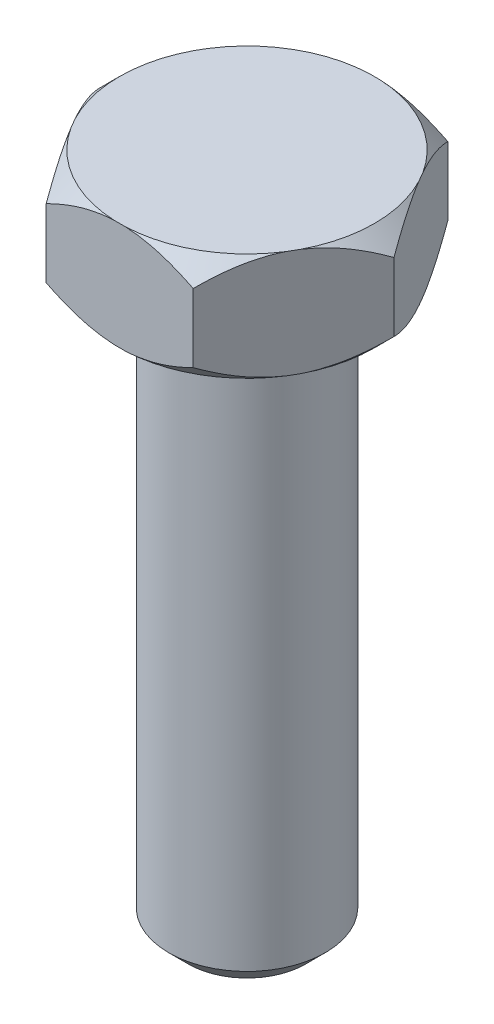
from build123d import *

# Parameters (mm, degrees)
EXTRUDE_1_DEPTH = 5.5
SKETCH_5_R      = 4
EXTRUDE_2_DEPTH = 29
CHAMFER_1_SIZE  = 1


with BuildPart() as part:
    # Эскиз1 → Вытянуть1 (new body)
    with BuildSketch(Plane(origin=(0, 0, 0), x_dir=(1, 0, 0), z_dir=(0, 1, 0))):
        Polygon((-3.75277675, 6.5), (3.75277675, 6.5), (7.505553499, 0), (3.75277675, -6.5), (-3.75277675, -6.5), (-7.505553499, 0), align=None)
    extrude(amount=-EXTRUDE_1_DEPTH)

    # Эскиз5 → Вытянуть2 (add)
    with BuildSketch(Plane.XZ.offset(5.5)):
        with Locations(Location((0, 0, 0), (0, 0, 90))):
            Circle(SKETCH_5_R)
    extrude(amount=EXTRUDE_2_DEPTH)

    # Фаска1
    chamfer_1_edges = [part.edges().sort_by_distance(p)[0] for p in [
        (0, -34.5, -4),
    ]]
    chamfer(chamfer_1_edges, length=CHAMFER_1_SIZE)

    # Эскиз4 → Вырез-Повернуть1 (revolve, cut)
    with BuildSketch(Plane.XY):
        Polygon((-7.505553499, -1), (-6.505553499, 0), (-7.505553499, 0), align=None)
        Polygon((-7.505553499, -4.5), (-6.505553499, -5.5), (-7.505553499, -5.5), align=None)
    revolve(axis=Axis((0, -5.5, 0), (0, -1, 0)), mode=Mode.SUBTRACT)


solid = part.part
